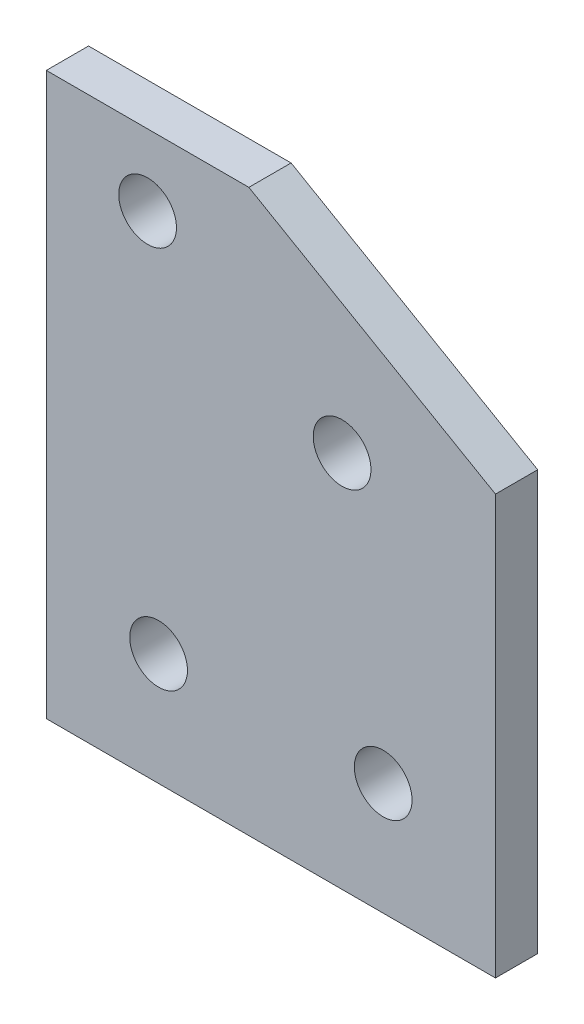
from build123d import *

# Parameters (mm, degrees)
BOSS_EXTRUDE1_DEPTH      = 2.3876
BOSS_EXTRUDE1_DEPTH_BACK = 2.3876
SKETCH3_R                = 3.2639


with BuildPart() as part:
    # Sketch3 → Boss-Extrude1 (new, two sides: drawn at the far end of the back side and taken through both)
    with BuildSketch(Plane.XY.offset(-BOSS_EXTRUDE1_DEPTH_BACK)):
        Polygon((25.4, -31.75), (25.4, 15.6464), (-2.4892, 31.75), (-25.4, 31.75), (-25.4, -31.75), align=None)
        with Locations((12.7, -19.05)):
            Circle(SKETCH3_R, mode=Mode.SUBTRACT)
        with Locations((8.052122612, 10.9982)):
            Circle(SKETCH3_R, mode=Mode.SUBTRACT)
        with Locations((-12.7, -19.05)):
            Circle(SKETCH3_R, mode=Mode.SUBTRACT)
        with Locations((-13.944922644, 23.6982)):
            Circle(SKETCH3_R, mode=Mode.SUBTRACT)
    extrude(amount=BOSS_EXTRUDE1_DEPTH + BOSS_EXTRUDE1_DEPTH_BACK)


solid = part.part
